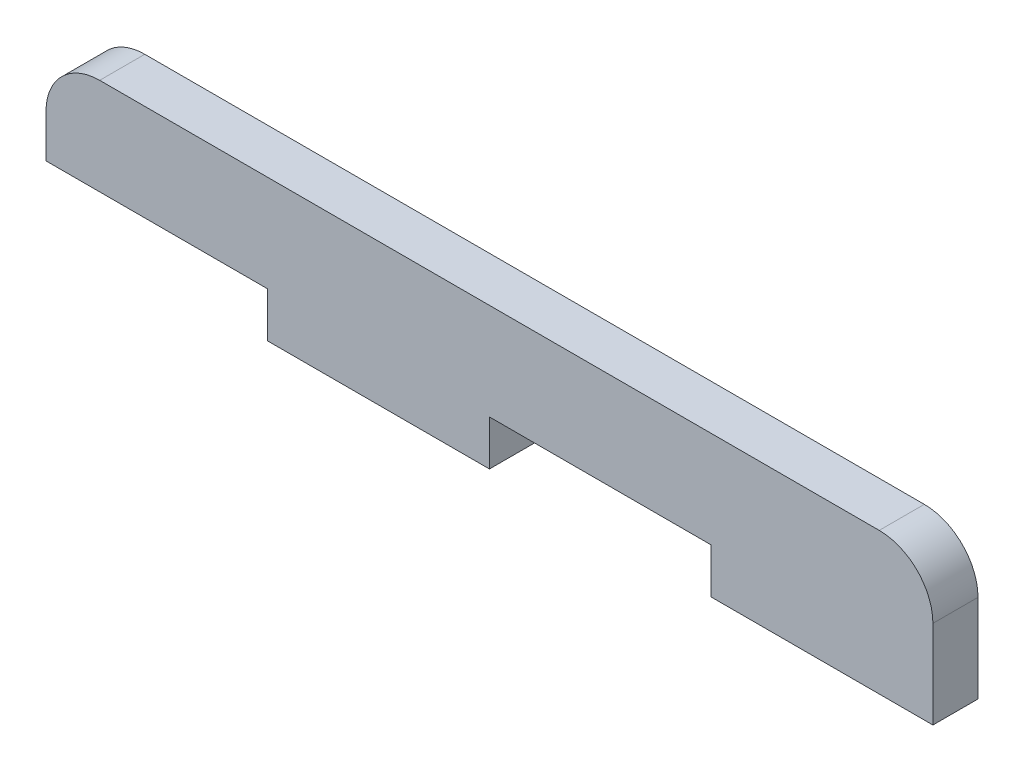
from build123d import *

# Parameters (mm, degrees)
SKETCH1_W           = 104.902
SKETCH1_H           = 16.764
BOSS_EXTRUDE1_DEPTH = 5.334
SKETCH2_W           = 26.2255
SKETCH2_H           = 5.334
CUT_EXTRUDE1_DEPTH  = 59.030232747
FILLET1_R           = 6.35


with BuildPart() as part:
    # Sketch1 → Boss-Extrude1 (new body)
    with BuildSketch(Plane.XY):
        with Locations((-4.604300362, -0.769451102)):
            Rectangle(SKETCH1_W, SKETCH1_H)
    extrude(amount=BOSS_EXTRUDE1_DEPTH)

    # Sketch2 → Cut-Extrude1 (cut, through all)
    with BuildSketch(Plane.XY.offset(5.334)):
        with Locations((-43.942550362, -6.484451102)):
            Rectangle(SKETCH2_W, SKETCH2_H)
        with Locations((8.508449638, -6.484451102)):
            Rectangle(SKETCH2_W, SKETCH2_H)
    extrude(amount=-CUT_EXTRUDE1_DEPTH, mode=Mode.SUBTRACT)

    # Fillet1
    fillet1_edges = [part.edges().sort_by_distance(p)[0] for p in [
        (-57.055300362, 7.612548898, 2.667),
        (47.846699638, 7.612548898, 2.667),
    ]]
    fillet(fillet1_edges, radius=FILLET1_R)


solid = part.part
